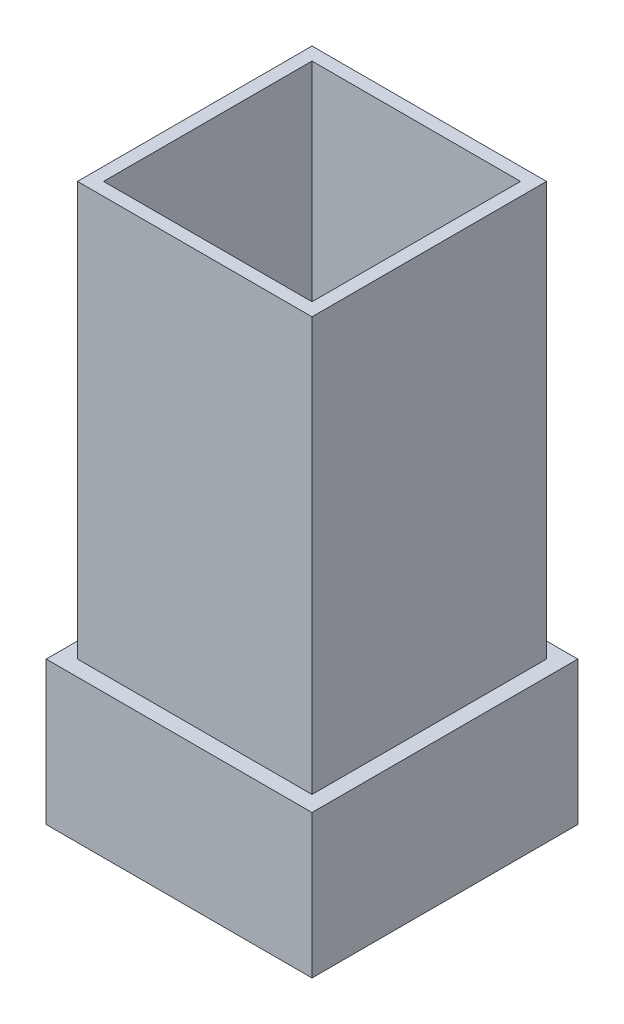
from build123d import *

# Parameters (mm, degrees)
SKETCH1_W            = 40.8
SKETCH1_H            = 40.8
SKETCH1_W_2          = 32
SKETCH1_H_2          = 32
BOSS_EXTRUDE1_DEPTH  = 10
SKETCH5_W            = 36
SKETCH5_H            = 36
SKETCH5_W_2          = 32
SKETCH5_H_2          = 32
BOSS_EXTRUDE5_DEPTH  = 63.5
SKETCH2_W            = 40.8
SKETCH2_H            = 40.8
SKETCH2_W_2          = 28
SKETCH2_H_2          = 28
BOSS_EXTRUDE9_DEPTH  = 2
SKETCH9_W            = 40.8
SKETCH9_H            = 40.8
SKETCH9_W_2          = 36.8
SKETCH9_H_2          = 36.8
BOSS_EXTRUDE11_DEPTH = 10


with BuildPart() as part:
    # Sketch1 → Boss-Extrude1 (new body)
    with BuildSketch(Plane(origin=(0, 0, 0), x_dir=(1, 0, 0), z_dir=(0, 1, 0))):
        with Locations((-61.04447382, 34.409277239)):
            Rectangle(SKETCH1_W, SKETCH1_H)
        with Locations((-61.04447382, 34.409277239)):
            Rectangle(SKETCH1_W_2, SKETCH1_H_2, mode=Mode.SUBTRACT)
    extrude(amount=BOSS_EXTRUDE1_DEPTH)

    # Sketch5 → Boss-Extrude5 (add)
    with BuildSketch(Plane(origin=(0, 10, 0), x_dir=(1, 0, 0), z_dir=(0, 1, 0))):
        with Locations((-61.04447382, 34.409277239)):
            Rectangle(SKETCH5_W, SKETCH5_H)
        with Locations((-61.04447382, 34.409277239)):
            Rectangle(SKETCH5_W_2, SKETCH5_H_2, mode=Mode.SUBTRACT)
    extrude(amount=BOSS_EXTRUDE5_DEPTH)

    # Sketch2 → Boss-Extrude9 (add)
    with BuildSketch(Plane.XZ):
        with Locations((-61.04447382, -34.409277239)):
            Rectangle(SKETCH2_W, SKETCH2_H)
        with Locations((-61.04447382, -34.409277239)):
            Rectangle(SKETCH2_W_2, SKETCH2_H_2, mode=Mode.SUBTRACT)
    extrude(amount=BOSS_EXTRUDE9_DEPTH)

    # Sketch9 → Boss-Extrude11 (add)
    with BuildSketch(Plane.XZ.offset(2)):
        with Locations((-61.04447382, -34.409277239)):
            Rectangle(SKETCH9_W, SKETCH9_H)
        with Locations((-61.04447382, -34.409277239)):
            Rectangle(SKETCH9_W_2, SKETCH9_H_2, mode=Mode.SUBTRACT)
    extrude(amount=BOSS_EXTRUDE11_DEPTH)


solid = part.part
